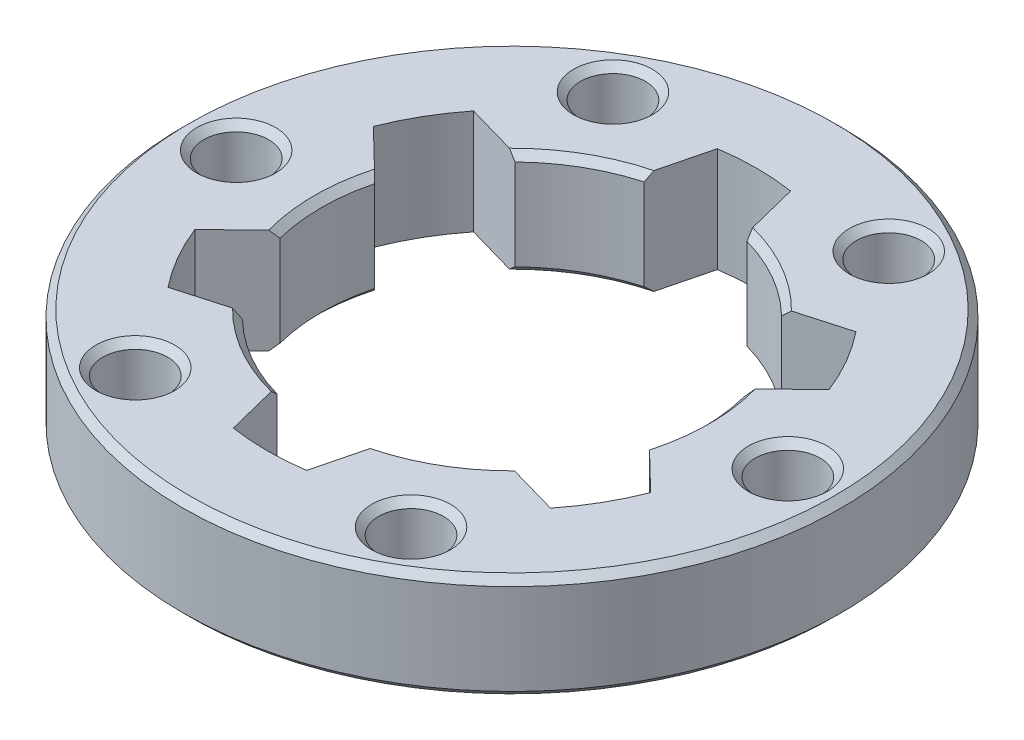
from build123d import *

# Parameters (mm, degrees)
ESBO_O1_W             = 19.9
ESBO_O1_H             = 15
ESBO_O2_R             = 4.65
CORTE_EXTRUS_O1_DEPTH = 69.415495321
CORTE_EXTRUS_O2_DEPTH = 69.415495321
CHANFRO1_SIZE         = 1
CHANFRO2_SIZE         = 1
CHANFRO3_SIZE         = 1
CHANFRO4_SIZE         = 1


with BuildPart() as part:
    # Esboço1 → Revolução1 (revolve)
    with BuildSketch(Plane.XY, mode=Mode.PRIVATE) as revolu_o1_sk:
        with Locations((37.25, 7.5)):
            Rectangle(ESBO_O1_W, ESBO_O1_H)
    revolve(revolu_o1_sk.sketch.rotate(Axis((0, -49.922822823, 0), (0, 1, 0)), 90), axis=Axis((0, -49.922822823, 0), (0, 1, 0)))

    # Esboço2 → Corte-extrusão1 (cut, through all)
    with BuildSketch(Plane(origin=(0, 15, 0), x_dir=(1, 0, 0), z_dir=(0, 1, 0))):
        with Locations(Location((-39.5, 0, 0), (0, 0, 270))):
            Circle(ESBO_O2_R)
        with Locations(Location((-19.75, 34.208003449, 0), (0, 0, 270))):
            Circle(ESBO_O2_R)
        with Locations(Location((19.75, 34.208003449, 0), (0, 0, 270))):
            Circle(ESBO_O2_R)
        with Locations(Location((39.5, 0, 0), (0, 0, 270))):
            Circle(ESBO_O2_R)
        with Locations(Location((19.75, -34.208003449, 0), (0, 0, 270))):
            Circle(ESBO_O2_R)
        with Locations(Location((-19.75, -34.208003449, 0), (0, 0, 270))):
            Circle(ESBO_O2_R)
    extrude(amount=-CORTE_EXTRUS_O1_DEPTH, mode=Mode.SUBTRACT)

    # Esboço3 → Corte-extrusão2 (cut, through all)
    with BuildSketch(Plane(origin=(0, 15, 0), x_dir=(1, 0, 0), z_dir=(0, 1, 0))):
        with BuildLine():
            Line((5.25, 34.654581227), (7.355, 26.290568176))
            ThreePointArc((7.355, 26.290568176), (0, 27.3), (-7.355, 26.290568176))
            Line((-7.355, 26.290568176), (-5.25, 34.654581227))
            ThreePointArc((-5.25, 34.654581227), (0, 35.05), (5.25, 34.654581227))
        make_face()
        with BuildLine():
            Line((32.6367477, 12.780657243), (26.44579992, 6.775667243))
            ThreePointArc((26.44579992, 6.775667243), (23.642493523, 13.65), (19.09079992, 19.514900933))
            Line((19.09079992, 19.514900933), (27.3867477, 21.873923983))
            ThreePointArc((27.3867477, 21.873923983), (30.354190403, 17.525), (32.6367477, 12.780657243))
        make_face()
        with BuildLine():
            Line((27.3867477, -21.873923983), (19.09079992, -19.514900933))
            ThreePointArc((19.09079992, -19.514900933), (23.642493523, -13.65), (26.44579992, -6.775667243))
            Line((26.44579992, -6.775667243), (32.6367477, -12.780657243))
            ThreePointArc((32.6367477, -12.780657243), (30.354190403, -17.525), (27.3867477, -21.873923983))
        make_face()
        with BuildLine():
            Line((-5.25, -34.654581227), (-7.355, -26.290568176))
            ThreePointArc((-7.355, -26.290568176), (0, -27.3), (7.355, -26.290568176))
            Line((7.355, -26.290568176), (5.25, -34.654581227))
            ThreePointArc((5.25, -34.654581227), (0, -35.05), (-5.25, -34.654581227))
        make_face()
        with BuildLine():
            Line((-32.6367477, -12.780657243), (-26.44579992, -6.775667243))
            ThreePointArc((-26.44579992, -6.775667243), (-23.642493523, -13.65), (-19.09079992, -19.514900933))
            Line((-19.09079992, -19.514900933), (-27.3867477, -21.873923983))
            ThreePointArc((-27.3867477, -21.873923983), (-30.354190403, -17.525), (-32.6367477, -12.780657243))
        make_face()
        with BuildLine():
            Line((-27.3867477, 21.873923983), (-19.09079992, 19.514900933))
            ThreePointArc((-19.09079992, 19.514900933), (-23.642493523, 13.65), (-26.44579992, 6.775667243))
            Line((-26.44579992, 6.775667243), (-32.6367477, 12.780657243))
            ThreePointArc((-32.6367477, 12.780657243), (-30.354190403, 17.525), (-27.3867477, 21.873923983))
        make_face()
    extrude(amount=-CORTE_EXTRUS_O2_DEPTH, mode=Mode.SUBTRACT)

    # Chanfro1
    chanfro1_edges = [part.edges().sort_by_distance(p)[0] for p in [
        (-13.65, 0, -23.642493523),
        (-13.65, 15, -23.642493523),
        (0, 0, 47.2),
        (0, 15, 47.2),
        (13.65, 15, -23.642493523),
        (27.3, 15, 0),
        (13.65, 15, 23.642493523),
        (-13.65, 15, 23.642493523),
        (-27.3, 0, 0),
        (-27.3, 15, 0),
    ]]
    chamfer(chanfro1_edges, length=CHANFRO1_SIZE)

    # Chanfro2
    chanfro2_edges = [part.edges().sort_by_distance(p)[0] for p in [
        (13.65, 0, -23.642493523),
        (27.3, 0, 0),
        (13.65, 0, 23.642493523),
        (-13.65, 0, 23.642493523),
    ]]
    chamfer(chanfro2_edges, length=CHANFRO2_SIZE)

    # Chanfro3
    chanfro3_edges = [part.edges().sort_by_distance(p)[0] for p in [
        (-39.5, 0, -4.65),
        (-19.75, 0, -38.858003449),
        (19.75, 0, -38.858003449),
        (39.5, 0, -4.65),
        (19.75, 0, 29.558003449),
        (-19.75, 0, 29.558003449),
    ]]
    chamfer(chanfro3_edges, length=CHANFRO3_SIZE)

    # Chanfro4
    chanfro4_edges = [part.edges().sort_by_distance(p)[0] for p in [
        (-39.5, 15, -4.65),
        (-19.75, 15, -38.858003449),
        (19.75, 15, -38.858003449),
        (39.5, 15, -4.65),
        (19.75, 15, 29.558003449),
        (-19.75, 15, 29.558003449),
    ]]
    chamfer(chanfro4_edges, length=CHANFRO4_SIZE)


solid = part.part
